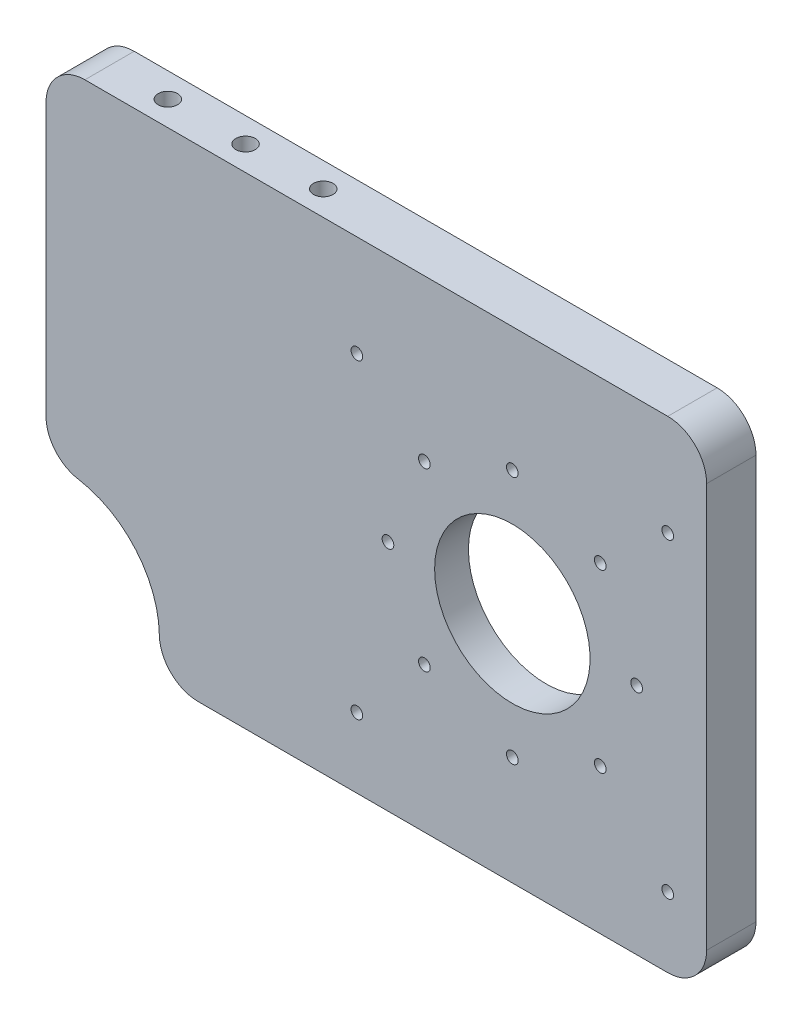
from build123d import *

# Parameters (mm, degrees)
SALIENTE_EXTRUIR1_DEPTH = 12.7
CROQUIS2_R              = 20
CORTAR_EXTRUIR1_DEPTH   = 12.7
CROQUIS4_R              = 3
CORTAR_EXTRUIR3_DEPTH   = 3
CROQUIS5_R              = 35
CORTAR_EXTRUIR4_DEPTH   = 4
CROQUIS6_R              = 1.5
CORTAR_EXTRUIR5_DEPTH   = 22
CROQUIS7_R              = 35
CORTAR_EXTRUIR6_DEPTH   = 10
CORTAR_EXTRUIR6_DRAFT   = -45
CROQUIS8_R              = 1.5
CORTAR_EXTRUIR7_DEPTH   = 29
CROQUIS9_R              = 2.5
CORTAR_EXTRUIR8_DEPTH   = 20
CROQUIS10_R             = 2.5
CORTAR_EXTRUIR9_DEPTH   = 20


with BuildPart() as part:
    # Croquis1 → Saliente-Extruir1 (new body)
    with BuildSketch(Plane.XY):
        with BuildLine():
            Line((-106.743982658, 74.697593063), (43.256017342, 74.697593063))
            ThreePointArc((43.256017342, 74.697593063), (50.327085153, 71.768660875), (53.256017342, 64.697593063))
            Line((53.256017342, 64.697593063), (53.256017342, 40.697593063))
            Line((53.256017342, 40.697593063), (53.256017342, -39.302406937))
            ThreePointArc((53.256017342, -39.302406937), (50.327085153, -46.373474748), (43.256017342, -49.302406937))
            Line((43.256017342, -49.302406937), (-46.743982658, -49.302406937))
            Line((-46.743982658, -49.302406937), (-77.581038689, -49.302406937))
            ThreePointArc((-77.581038689, -49.302406937), (-84.60035231, -46.424852885), (-87.579975061, -39.448254194))
            ThreePointArc((-87.579975061, -39.448254194), (-93.601441457, -23.536626284), (-108.410649325, -15.162539908))
            ThreePointArc((-108.410649325, -15.162539908), (-114.381608817, -11.75737918), (-116.743982658, -5.302406937))
            Line((-116.743982658, -5.302406937), (-116.743982658, 64.697593063))
            ThreePointArc((-116.743982658, 64.697593063), (-113.81505047, 71.768660875), (-106.743982658, 74.697593063))
        make_face()
    extrude(amount=SALIENTE_EXTRUIR1_DEPTH)

    # Croquis2 → Cortar-Extruir1 (cut)
    with BuildSketch(Plane(origin=(0, 0, 0), x_dir=(-1, 0, 0), z_dir=(0, 0, -1))):
        with Locations((-3.256017342, 10.697593063)):
            Circle(CROQUIS2_R)
    extrude(amount=-CORTAR_EXTRUIR1_DEPTH, mode=Mode.SUBTRACT)

    # Croquis4 → Cortar-Extruir3 (cut)
    with BuildSketch(Plane(origin=(0, 0, 0), x_dir=(-1, 0, 0), z_dir=(0, 0, -1))):
        with Locations((36.743982658, 48.697593063)):
            Circle(CROQUIS4_R)
        with Locations((-43.256017342, 48.697593063)):
            Circle(CROQUIS4_R)
        with Locations((36.743982658, -31.302406937)):
            Circle(CROQUIS4_R)
        with Locations((-43.256017342, -31.302406937)):
            Circle(CROQUIS4_R)
    extrude(amount=-CORTAR_EXTRUIR3_DEPTH, mode=Mode.SUBTRACT)

    # Croquis5 → Cortar-Extruir4 (cut)
    with BuildSketch(Plane(origin=(0, 0, 0), x_dir=(-1, 0, 0), z_dir=(0, 0, -1))):
        with Locations((-3.256017342, 10.697593063)):
            Circle(CROQUIS5_R)
    extrude(amount=-CORTAR_EXTRUIR4_DEPTH, mode=Mode.SUBTRACT)

    # Croquis6 → Cortar-Extruir5 (cut)
    with BuildSketch(Plane(origin=(0, 0, 4), x_dir=(-1, 0, 0), z_dir=(0, 0, -1))):
        with Locations((-3.256017342, 42.697593063)):
            Circle(CROQUIS6_R)
        with Locations((19.371399656, 33.325010061)):
            Circle(CROQUIS6_R)
        with Locations((28.743982658, 10.697593063)):
            Circle(CROQUIS6_R)
        with Locations((19.371399656, -11.929823935)):
            Circle(CROQUIS6_R)
        with Locations((-3.256017342, -21.302406937)):
            Circle(CROQUIS6_R)
        with Locations((-25.88343434, -11.929823935)):
            Circle(CROQUIS6_R)
        with Locations((-35.256017342, 10.697593063)):
            Circle(CROQUIS6_R)
        with Locations((-25.88343434, 33.325010061)):
            Circle(CROQUIS6_R)
    extrude(amount=-CORTAR_EXTRUIR5_DEPTH, mode=Mode.SUBTRACT)


with BuildPart() as cortar_extruir6_tool:
    # Croquis7 → Cortar-Extruir6 (with draft: the straight prism first)
    with BuildSketch(Plane(origin=(0, 0, 4), x_dir=(-1, 0, 0), z_dir=(0, 0, -1))):
        with Locations((-3.256017342, 10.697593063)):
            Circle(CROQUIS7_R)
    extrude(amount=CORTAR_EXTRUIR6_DEPTH)
    # Cortar-Extruir6: the draft: its side faces are tilted about the plane it starts from
    cortar_extruir6_sides = [cortar_extruir6_tool.faces().sort_by_distance(p)[0] for p in [
        (38.256017342, 10.697593063, -1),
    ]]
    draft(cortar_extruir6_sides, Plane(origin=(0, 0, 4), x_dir=(-1, 0, 0), z_dir=(0, 0, -1)), CORTAR_EXTRUIR6_DRAFT)


with BuildPart() as part_1:
    add(part.part)

    # Cortar-Extruir6: cut by cortar_extruir6_tool
    add(cortar_extruir6_tool.part, mode=Mode.SUBTRACT)

    # Croquis8 → Cortar-Extruir7 (cut)
    with BuildSketch(Plane(origin=(0, 0, 0), x_dir=(-1, 0, 0), z_dir=(0, 0, -1))):
        with Locations((-43.256017342, 48.697593063)):
            Circle(CROQUIS8_R)
        with Locations((36.743982658, 48.697593063)):
            Circle(CROQUIS8_R)
        with Locations((36.743982658, -31.302406937)):
            Circle(CROQUIS8_R)
        with Locations((-43.256017342, -31.302406937)):
            Circle(CROQUIS8_R)
    extrude(amount=-CORTAR_EXTRUIR7_DEPTH, mode=Mode.SUBTRACT)

    # Croquis9 → Cortar-Extruir8 (cut)
    with BuildSketch(Plane(origin=(0, 74.697593063, 0), x_dir=(1, 0, 0), z_dir=(0, 1, 0))):
        with Locations(Location((-91.743982658, -6.35, 0), (0, 0, 270))):
            Circle(CROQUIS9_R)
        with Locations(Location((-71.743982658, -6.35, 0), (0, 0, 270))):
            Circle(CROQUIS9_R)
        with Locations(Location((-51.743982658, -6.35, 0), (0, 0, 270))):
            Circle(CROQUIS9_R)
    extrude(amount=-CORTAR_EXTRUIR8_DEPTH, mode=Mode.SUBTRACT)

    # Croquis10 → Cortar-Extruir9 (cut)
    with BuildSketch(Plane.ZY.offset(116.743982658)):
        with Locations((6.35, 49.697593063)):
            Circle(CROQUIS10_R)
        with Locations((6.35, 29.697593063)):
            Circle(CROQUIS10_R)
        with Locations((6.35, 9.697593063)):
            Circle(CROQUIS10_R)
    extrude(amount=-CORTAR_EXTRUIR9_DEPTH, mode=Mode.SUBTRACT)


solid = part_1.part
